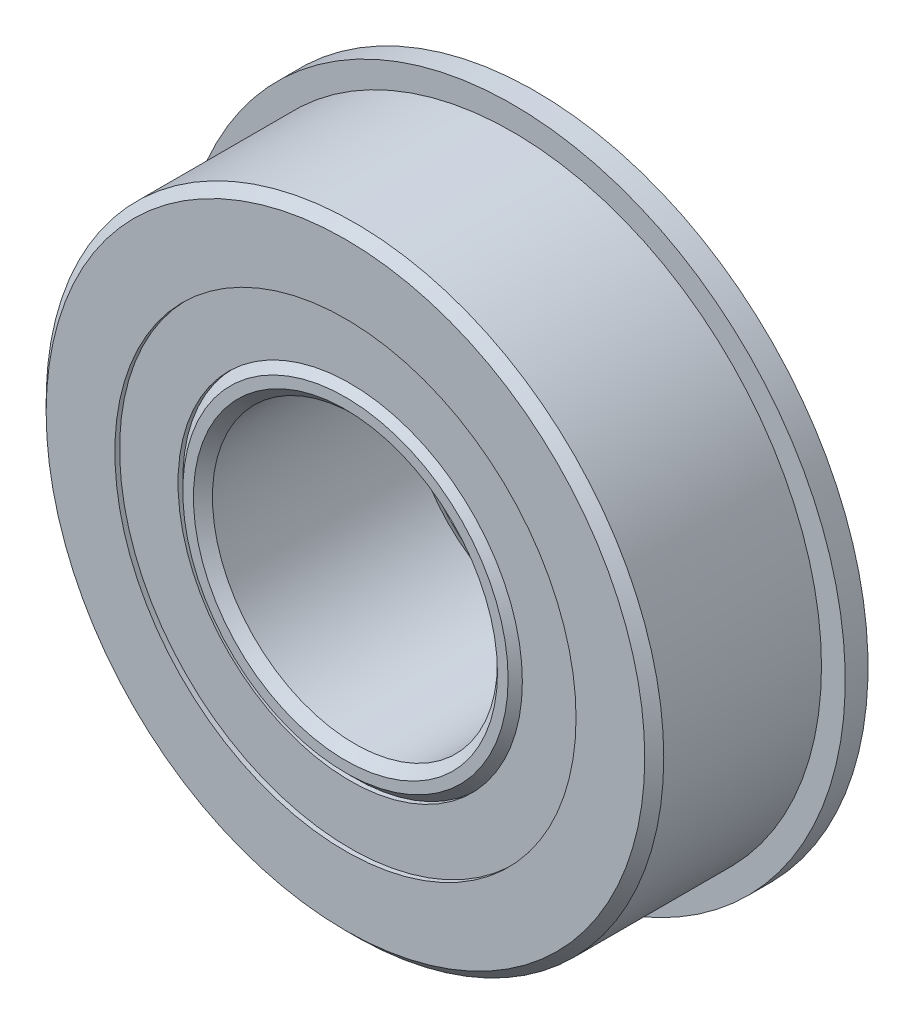
from build123d import *

# Parameters (mm, degrees)
SKETCH6_W         = 1.524
SKETCH6_H         = 6.814608333
CIRPATTERN1_COUNT = 12
SKETCH5_W         = 3.765314827
SKETCH5_H         = 3.904191667


with BuildPart() as part:
    # Sketch1 → Revolve1 (revolve)
    with BuildSketch(Plane(origin=(0, 0, 0), x_dir=(0, 0, -1), z_dir=(1, 0, 0))):
        with BuildLine():
            Line((5.715, 20.6375), (-5.715, 20.6375))
            Line((-5.715, 20.6375), (-6.35, 20.0025))
            Line((-6.35, 20.0025), (-6.35, 15.410391667))
            Line((-6.35, 15.410391667), (-4.220518555, 15.410391667))
            ThreePointArc((-4.220518555, 15.410391667), (0, 19.314583333), (4.220518555, 15.410391667))
            Line((4.220518555, 15.410391667), (6.35, 15.410391667))
            Line((6.35, 15.410391667), (6.35, 20.0025))
            Line((6.35, 20.0025), (5.715, 20.6375))
        make_face()
    revolve(axis=Axis((0, 0, 6.35), (0, 0, -1)))

    # Sketch6 → Revolve6 (revolve)
    with BuildSketch(Plane(origin=(0, 0, 0), x_dir=(0, 0, -1), z_dir=(1, 0, 0))):
        with Locations((5.588, 18.817695834)):
            Rectangle(SKETCH6_W, SKETCH6_H)
    revolve(axis=Axis((0, 0, -6.35), (0, 0, 1)))


with BuildPart() as body_2:
    # Sketch3 → Revolve3 (revolve)
    with BuildSketch(Plane(origin=(0, 0, 0), x_dir=(0, 0, -1), z_dir=(1, 0, 0))):
        with BuildLine():
            Line((-6.35, 10.16), (-6.35, 10.8712))
            Line((-6.35, 10.8712), (-5.715, 11.5062))
            Line((-5.715, 11.5062), (-2.267185173, 11.5062))
            ThreePointArc((-2.267185173, 11.5062), (0, 10.847916667), (2.267185173, 11.5062))
            Line((2.267185173, 11.5062), (7.3152, 11.5062))
            Line((7.3152, 11.5062), (7.9502, 10.8712))
            Line((7.9502, 10.8712), (7.9502, 10.16))
            Line((7.9502, 10.16), (7.3152, 9.525))
            Line((7.3152, 9.525), (-5.715, 9.525))
            Line((-5.715, 9.525), (-6.35, 10.16))
        make_face()
    revolve(axis=Axis((0, 0, 6.35), (0, 0, -1)))


with BuildPart() as body_3:
    # Sketch4 → Revolve4 (revolve)
    with BuildSketch(Plane(origin=(0, 0, 0), x_dir=(0, 0, -1), z_dir=(1, 0, 0))):
        with BuildLine():
            Line((-4.233333333, 15.08125), (4.233333333, 15.08125))
            ThreePointArc((4.233333333, 15.08125), (0, 19.314583333), (-4.233333333, 15.08125))
        make_face()
    revolve(axis=Axis((0, 15.08125, 4.233333333), (0, 0, -1)))


with BuildPart() as cirpattern1_1:
    # CirPattern1: pattern copy
    add(body_3.part.rotate(Axis((0, 0, -6.35), (0, 0, 1)), 1 * 360 / CIRPATTERN1_COUNT))


with BuildPart() as cirpattern1_2:
    # CirPattern1: pattern copy
    add(body_3.part.rotate(Axis((0, 0, -6.35), (0, 0, 1)), 2 * 360 / CIRPATTERN1_COUNT))


with BuildPart() as cirpattern1_3:
    # CirPattern1: pattern copy
    add(body_3.part.rotate(Axis((0, 0, -6.35), (0, 0, 1)), 3 * 360 / CIRPATTERN1_COUNT))


with BuildPart() as cirpattern1_4:
    # CirPattern1: pattern copy
    add(body_3.part.rotate(Axis((0, 0, -6.35), (0, 0, 1)), 4 * 360 / CIRPATTERN1_COUNT))


with BuildPart() as cirpattern1_5:
    # CirPattern1: pattern copy
    add(body_3.part.rotate(Axis((0, 0, -6.35), (0, 0, 1)), 5 * 360 / CIRPATTERN1_COUNT))


with BuildPart() as cirpattern1_6:
    # CirPattern1: pattern copy
    add(body_3.part.rotate(Axis((0, 0, -6.35), (0, 0, 1)), 6 * 360 / CIRPATTERN1_COUNT))


with BuildPart() as cirpattern1_7:
    # CirPattern1: pattern copy
    add(body_3.part.rotate(Axis((0, 0, -6.35), (0, 0, 1)), 7 * 360 / CIRPATTERN1_COUNT))


with BuildPart() as cirpattern1_8:
    # CirPattern1: pattern copy
    add(body_3.part.rotate(Axis((0, 0, -6.35), (0, 0, 1)), 8 * 360 / CIRPATTERN1_COUNT))


with BuildPart() as cirpattern1_9:
    # CirPattern1: pattern copy
    add(body_3.part.rotate(Axis((0, 0, -6.35), (0, 0, 1)), 9 * 360 / CIRPATTERN1_COUNT))


with BuildPart() as cirpattern1_10:
    # CirPattern1: pattern copy
    add(body_3.part.rotate(Axis((0, 0, -6.35), (0, 0, 1)), 10 * 360 / CIRPATTERN1_COUNT))


with BuildPart() as cirpattern1_11:
    # CirPattern1: pattern copy
    add(body_3.part.rotate(Axis((0, 0, -6.35), (0, 0, 1)), 11 * 360 / CIRPATTERN1_COUNT))


with BuildPart() as body_15:
    # Sketch5 → Revolve5 (revolve)
    with BuildSketch(Plane(origin=(0, 0, 0), x_dir=(0, 0, -1), z_dir=(1, 0, 0))):
        with Locations((-4.149842587, 13.458295834)):
            Rectangle(SKETCH5_W, SKETCH5_H)
        with Locations((4.149842587, 13.458295834)):
            Rectangle(SKETCH5_W, SKETCH5_H)
    revolve(axis=Axis((0, 0, 6.35), (0, 0, -1)))


solid = Compound([part.part, body_2.part, body_3.part, cirpattern1_1.part, cirpattern1_2.part, cirpattern1_3.part, cirpattern1_4.part, cirpattern1_5.part, cirpattern1_6.part, cirpattern1_7.part, cirpattern1_8.part, cirpattern1_9.part, cirpattern1_10.part, cirpattern1_11.part, body_15.part])
